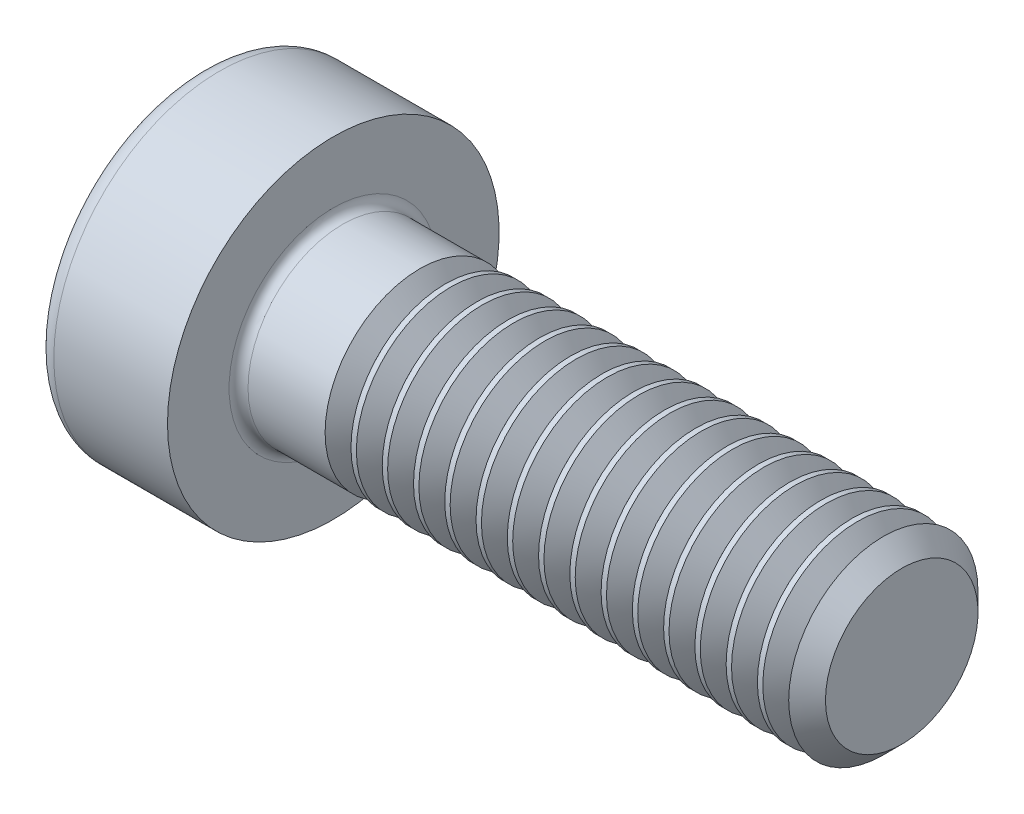
from build123d import *

# Parameters (mm, degrees)
FILLET1_R       = 0.2
FILLET2_R       = 0.4
HEX_2_DEPTH     = 2.3
THDSCHPAT_COUNT = 15
THDSCHPAT_PITCH = 0.66


with BuildPart() as part:
    # BodySke → Base-Revolve (revolve)
    with BuildSketch(Plane.XY, mode=Mode.PRIVATE) as base_revolve_sk:
        Polygon((0, 0), (0, 3.5), (2.8, 3.5), (2.8, 2), (14.41, 2), (14.8, 1.61), (14.8, 0), align=None)
    revolve(base_revolve_sk.sketch.rotate(Axis((-31.75, 0, 0), (1, 0, 0)), 90), axis=Axis((-31.75, 0, 0), (1, 0, 0)))

    # Fillet1
    fillet1_edges = [part.edges().sort_by_distance(p)[0] for p in [
        (2.8, 0, -2),
    ]]
    fillet(fillet1_edges, radius=FILLET1_R)

    # Fillet2
    fillet2_edges = [part.edges().sort_by_distance(p)[0] for p in [
        (0, 0, -3.5),
    ]]
    fillet(fillet2_edges, radius=FILLET2_R)

    # Sketch2 → Hex-PreBroach (revolve, cut)
    with BuildSketch(Plane.XY, mode=Mode.PRIVATE) as hex_prebroach_sk:
        Polygon((0, 1.25), (2.3, 1.25), (3.021687836, 0), (0, 0), align=None)
    revolve(hex_prebroach_sk.sketch.rotate(Axis((0, 0, 0), (1, 0, 0)), 90), axis=Axis((0, 0, 0), (1, 0, 0)), mode=Mode.SUBTRACT)

    # Sketch3 → Hex 2 (cut)
    with BuildSketch(Plane(origin=(0, 0, 0), x_dir=(0, 0.500000000000001, 0.866025403784438), z_dir=(-1, 0, 0))):
        Polygon((0.721687836, 1.25), (-0.721687836, 1.25), (-1.443375673, 0), (-0.721687836, -1.25), (0.721687836, -1.25), (1.443375673, 0), align=None)
    extrude(amount=-HEX_2_DEPTH, mode=Mode.SUBTRACT)

    # ThdSchSke → ThreadSchematic (revolve, cut)
    with BuildSketch(Plane.XY):
        Polygon((4.9, -1.61), (4.62691906, -2), (4.62691906, -2.5), (5.17308094, -2.5), (5.17308094, -2), align=None)
    threadschematic = revolve(axis=Axis((-3.175, 0, 0), (1, 0, 0)), mode=Mode.SUBTRACT)

    # ThdSchPat: ThreadSchematic ×15
    with Locations(*[(i * THDSCHPAT_PITCH, 0, 0) for i in range(1, THDSCHPAT_COUNT)]):
        add(threadschematic, mode=Mode.SUBTRACT)


solid = part.part
